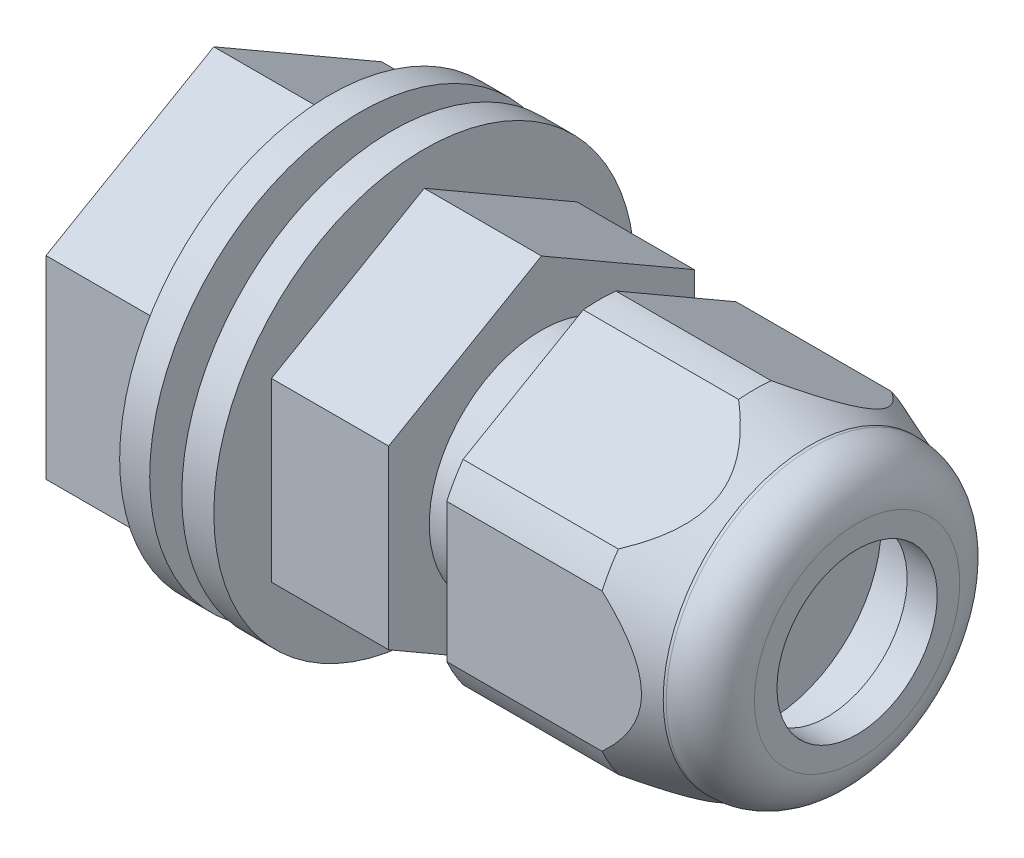
from build123d import *

# Parameters (mm, degrees)
SKETCH1_R           = 6.2
BOSS_EXTRUDE1_DEPTH = 10.8
BOSS_EXTRUDE2_DEPTH = 5.85
SKETCH3_R           = 5.6
BOSS_EXTRUDE3_DEPTH = 11.35
SKETCH4_R           = 10.5
BOSS_EXTRUDE4_DEPTH = 1.6
SKETCH5_R           = 10.5
BOSS_EXTRUDE5_DEPTH = 7.3
SKETCH6_R           = 13.375
CUT_EXTRUDE1_DEPTH  = 5.8
SKETCH7_R           = 4
CUT_EXTRUDE2_DEPTH  = 16.5
SKETCH8_R           = 1.9
CUT_EXTRUDE3_DEPTH  = 11.5
SKETCH10_R          = 12.625
CUT_EXTRUDE4_DEPTH  = 12.85


with BuildPart() as part:
    # Sketch1 → Boss-Extrude1 (new body)
    with BuildSketch(Plane(origin=(0, 0, 0), x_dir=(0, 0, -1), z_dir=(1, 0, 0))):
        with Locations(Location((0, 0, 0), (0, 0, 180))):
            Circle(SKETCH1_R)
    extrude(amount=BOSS_EXTRUDE1_DEPTH)

    # Sketch2 → Boss-Extrude2 (add)
    with BuildSketch(Plane(origin=(10.8, 0, 0), x_dir=(0, 0, -1), z_dir=(1, 0, 0))):
        Polygon((0, -8.804591605), (7.625, -4.402295803), (7.625, 4.402295803), (0, 8.804591605), (-7.625, 4.402295803), (-7.625, -4.402295803), align=None)
    extrude(amount=BOSS_EXTRUDE2_DEPTH)

    # Sketch3 → Boss-Extrude3 (add)
    with BuildSketch(Plane(origin=(16.65, 0, 0), x_dir=(0, 0, -1), z_dir=(1, 0, 0))):
        Circle(SKETCH3_R)
    extrude(amount=BOSS_EXTRUDE3_DEPTH)

    # Sketch4 → Boss-Extrude4 (add)
    with BuildSketch(Plane.ZY.offset(-10.8)):
        Circle(SKETCH4_R)
    extrude(amount=BOSS_EXTRUDE4_DEPTH)

    # Sketch5 → Boss-Extrude5 (add)
    with BuildSketch(Plane.ZY.offset(-7.6)):
        Circle(SKETCH5_R)
    extrude(amount=BOSS_EXTRUDE5_DEPTH)

    # Sketch6 → Cut-Extrude1 (cut)
    with BuildSketch(Plane.ZY.offset(-0.3)):
        Circle(SKETCH6_R)
        Polygon((0, -9.670617009), (8.375, -4.835308504), (8.375, 4.835308504), (0, 9.670617009), (-8.375, 4.835308504), (-8.375, -4.835308504), align=None, mode=Mode.SUBTRACT)
    extrude(amount=-CUT_EXTRUDE1_DEPTH, mode=Mode.SUBTRACT)

    # Sketch7 → Cut-Extrude2 (cut)
    with BuildSketch(Plane.ZY):
        Circle(SKETCH7_R)
    extrude(amount=-CUT_EXTRUDE2_DEPTH, mode=Mode.SUBTRACT)

    # Sketch8 → Cut-Extrude3 (cut)
    with BuildSketch(Plane(origin=(28, 0, 0), x_dir=(0, 0, -1), z_dir=(1, 0, 0))):
        Circle(SKETCH8_R)
    extrude(amount=-CUT_EXTRUDE3_DEPTH, mode=Mode.SUBTRACT)

    # Sketch9 → Revolve1 (revolve)
    with BuildSketch(Plane.XY, mode=Mode.PRIVATE) as revolve1_sk:
        with BuildLine():
            Line((19.55, 8.375), (27.3, 8.375))
            Line((27.3, 8.375), (30.05, 7.325))
            Line((30.05, 7.325), (30.2, 7.325))
            ThreePointArc((30.2, 7.325), (31.755634919, 6.680634919), (32.4, 5.125))
            Line((32.4, 5.125), (32.4, 4))
            Line((32.4, 4), (30.9, 4))
            Line((30.9, 4), (30.9, 5.125))
            ThreePointArc((30.9, 5.125), (30.760875721, 5.460875721), (30.425, 5.6))
            Line((30.425, 5.6), (19.55, 5.6))
            Line((19.55, 5.6), (19.55, 8.375))
        make_face()
    revolve(revolve1_sk.sketch.rotate(Axis((0, 0, 0), (1, 0, 0)), 90), axis=Axis((0, 0, 0), (1, 0, 0)))

    # Sketch10 → Cut-Extrude4 (cut)
    with BuildSketch(Plane(origin=(32.4, 0, 0), x_dir=(0, 0, -1), z_dir=(1, 0, 0))):
        Circle(SKETCH10_R)
        Polygon((7.625, -4.402295803), (7.625, 4.402295803), (0, 8.804591605), (-7.625, 4.402295803), (-7.625, -4.402295803), (0, -8.804591605), align=None, mode=Mode.SUBTRACT)
    extrude(amount=-CUT_EXTRUDE4_DEPTH, mode=Mode.SUBTRACT)


solid = part.part
